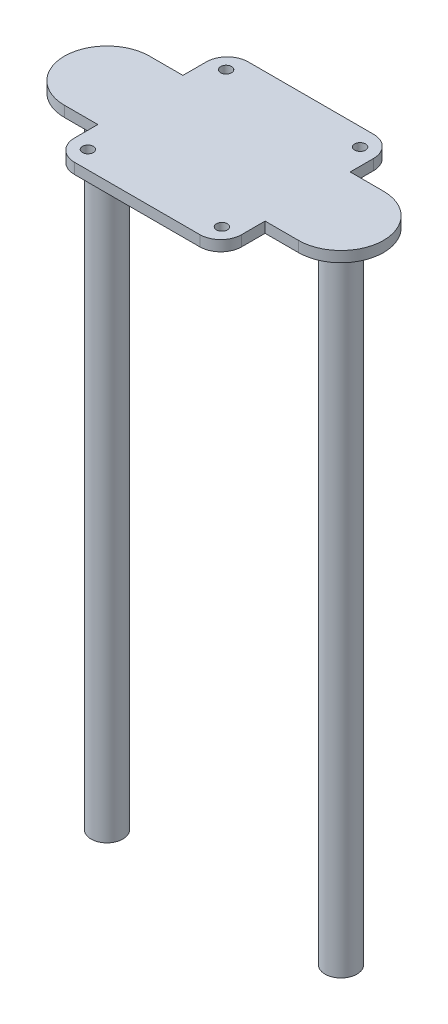
from build123d import *

# Parameters (mm, degrees)
SKETCH1_R           = 1.3
BOSS_EXTRUDE1_DEPTH = 2.54
SKETCH1_3_R         = 3.81
BOSS_EXTRUDE2_DEPTH = 152.4


with BuildPart() as part:
    # Sketch1 → Boss-Extrude1 (new body)
    with BuildSketch(Plane(origin=(0, 0, 0), x_dir=(1, 0, 0), z_dir=(0, 1, 0))):
        with BuildLine():
            Line((14.969429072, 20.75), (-14.969429072, 20.75))
            ThreePointArc((-14.969429072, 20.75), (-18.504962978, 19.285533906), (-19.969429072, 15.75))
            Line((-19.969429072, 15.75), (-19.969429072, 10.16))
            Line((-19.969429072, 10.16), (-27.94, 10.16))
            ThreePointArc((-27.94, 10.16), (-38.1, 0), (-27.94, -10.16))
            Line((-27.94, -10.16), (-19.969429072, -10.16))
            Line((-19.969429072, -10.16), (-19.969429072, -15.75))
            ThreePointArc((-19.969429072, -15.75), (-18.504962978, -19.285533906), (-14.969429072, -20.75))
            Line((-14.969429072, -20.75), (14.969429072, -20.75))
            ThreePointArc((14.969429072, -20.75), (18.504962978, -19.285533906), (19.969429072, -15.75))
            Line((19.969429072, -15.75), (19.969429072, -10.16))
            Line((19.969429072, -10.16), (27.94, -10.16))
            ThreePointArc((27.94, -10.16), (38.1, 0), (27.94, 10.16))
            Line((27.94, 10.16), (19.969429072, 10.16))
            Line((19.969429072, 10.16), (19.969429072, 15.75))
            ThreePointArc((19.969429072, 15.75), (18.504962978, 19.285533906), (14.969429072, 20.75))
        make_face()
        with Locations((-16, 16.5)):
            Circle(SKETCH1_R, mode=Mode.SUBTRACT)
        with Locations((16, 16.5)):
            Circle(SKETCH1_R, mode=Mode.SUBTRACT)
        with Locations((16, -16.5)):
            Circle(SKETCH1_R, mode=Mode.SUBTRACT)
        with Locations((-16, -16.5)):
            Circle(SKETCH1_R, mode=Mode.SUBTRACT)
    extrude(amount=BOSS_EXTRUDE1_DEPTH)

    # Sketch1<3> → Boss-Extrude2 (add)
    with BuildSketch(Plane(origin=(0, 0, 0), x_dir=(1, 0, 0), z_dir=(0, 1, 0))):
        with Locations((-27.94, 0)):
            Circle(SKETCH1_3_R)
        with Locations((27.94, 0)):
            Circle(SKETCH1_3_R)
    extrude(amount=-BOSS_EXTRUDE2_DEPTH)


solid = part.part
